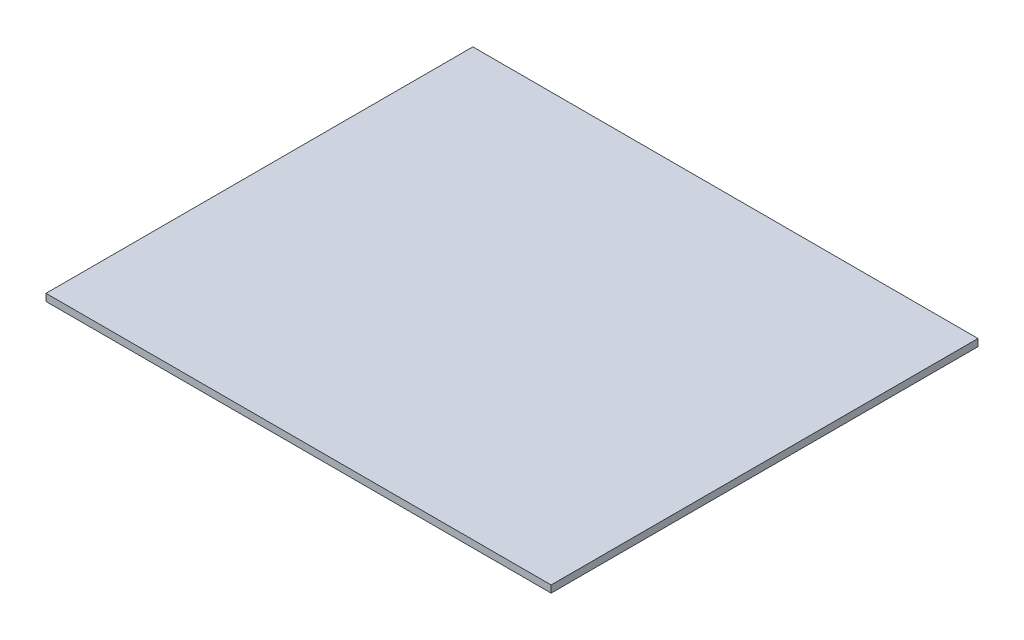
from build123d import *

# Parameters (mm, degrees)
SKETCH1_W           = 1219.2
SKETCH1_H           = 609.6
BOSS_EXTRUDE1_DEPTH = 6.35
CUT_EXTRUDE1_REACH  = 1365.122
SKETCH9_W           = 450.85
SKETCH9_H           = 381
CUT_EXTRUDE2_DEPTH  = 6.35


with BuildPart() as part:
    # Sketch1 → Boss-Extrude1 (new body)
    with BuildSketch(Plane(origin=(0, 0, 0), x_dir=(1, 0, 0), z_dir=(0, 1, 0))):
        with Locations((609.6, 304.8)):
            Rectangle(SKETCH1_W, SKETCH1_H)
    extrude(amount=BOSS_EXTRUDE1_DEPTH)

    # Sketch7 → Cut-Extrude1 (cut, up to next)
    with BuildSketch(Plane(origin=(0, 6.35, 0), x_dir=(1, 0, 0), z_dir=(0, 1, 0)), mode=Mode.PRIVATE) as cut_extrude1_sk1:
        Polygon((501.65, 381), (952.5, 381), (952.5, 0), (1219.2, 0), (1219.2, 381), (1219.2, 609.6), (0, 609.6), (0, 381), (450.85, 381), (450.85, 0), (501.65, 0), align=None)
    cut_extrude1_tool1 = extrude(cut_extrude1_sk1.sketch, amount=-CUT_EXTRUDE1_REACH, mode=Mode.PRIVATE) & part.part
    add(cut_extrude1_tool1.solids().sort_by_distance((724.222881, 6.35, -403.048184))[0], mode=Mode.SUBTRACT)


with BuildPart() as cut_extrude1_piece_1:
    # of the separate pieces the step leaves, piece 1, a body of its own (cut_extrude1_pieces)
    add(part.part.solids().sort_by_distance((0, 0, 0))[0])


with BuildPart() as cut_extrude1_piece_2:
    # of the separate pieces the step leaves, piece 2, a body of its own (cut_extrude1_pieces)
    add(part.part.solids().sort_by_distance((501.65, 0, 0))[0])

    # Sketch9 → Cut-Extrude2 (cut)
    with BuildSketch(Plane(origin=(0, 6.35, 0), x_dir=(1, 0, 0), z_dir=(0, 1, 0))):
        with Locations((727.075, 190.5)):
            Rectangle(SKETCH9_W, SKETCH9_H)
    extrude(amount=-CUT_EXTRUDE2_DEPTH, mode=Mode.SUBTRACT)


solid = cut_extrude1_piece_1.part
